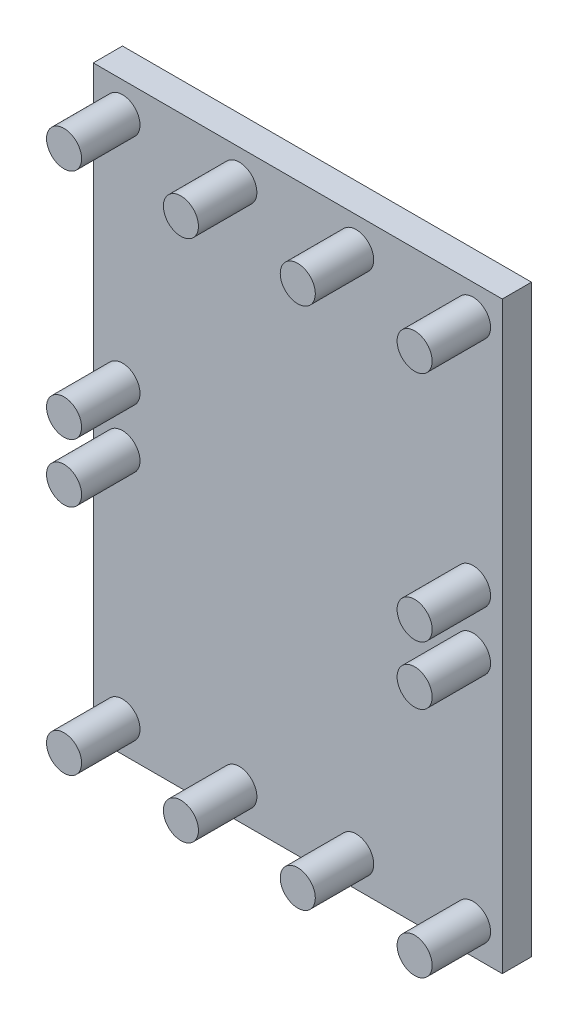
from build123d import *

# Parameters (mm, degrees)
SKETCH1_W           = 80
SKETCH1_H           = 56
BOSS_EXTRUDE1_DEPTH = 4
SKETCH2_R           = 2.4
BOSS_EXTRUDE2_DEPTH = 8


with BuildPart() as part:
    # Sketch1 → Boss-Extrude1 (new body)
    with BuildSketch(Plane(origin=(0, 0, 0), x_dir=(0, 1, 0), z_dir=(0, 0, 1))):
        with Locations((40, 28)):
            Rectangle(SKETCH1_W, SKETCH1_H)
    extrude(amount=BOSS_EXTRUDE1_DEPTH)

    # Sketch2 → Boss-Extrude2 (add)
    with BuildSketch(Plane.XY.offset(4)):
        with Locations((-4, 4.172184478)):
            Circle(SKETCH2_R)
        with Locations((-20, 4.172184478)):
            Circle(SKETCH2_R)
        with Locations((-36, 4.172184478)):
            Circle(SKETCH2_R)
        with Locations((-52, 4.172184478)):
            Circle(SKETCH2_R)
        with Locations(Location((-52, 75.827815522, 0), (0, 0, 180))):
            Circle(SKETCH2_R)
        with Locations(Location((-36, 75.827815522, 0), (0, 0, 180))):
            Circle(SKETCH2_R)
        with Locations(Location((-20, 75.827815522, 0), (0, 0, 180))):
            Circle(SKETCH2_R)
        with Locations(Location((-4, 75.827815522, 0), (0, 0, 180))):
            Circle(SKETCH2_R)
        with Locations((-4, 36)):
            Circle(SKETCH2_R)
        with Locations(Location((-4, 44, 0), (0, 0, 180))):
            Circle(SKETCH2_R)
        with Locations((-52, 44)):
            Circle(SKETCH2_R)
        with Locations(Location((-52, 36, 0), (0, 0, 180))):
            Circle(SKETCH2_R)
    extrude(amount=BOSS_EXTRUDE2_DEPTH)


solid = part.part
